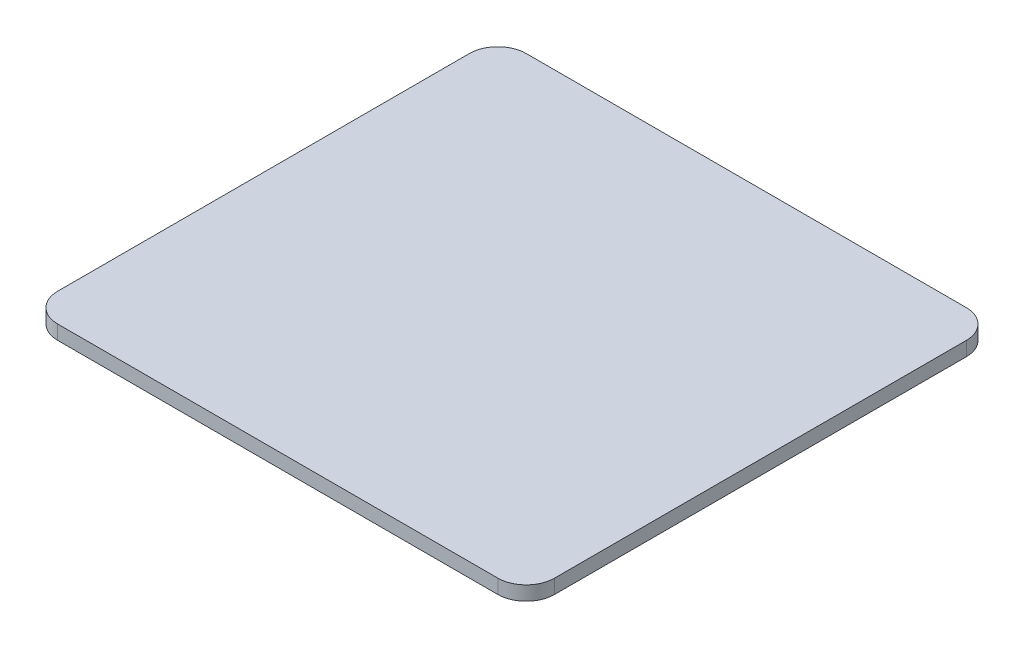
from build123d import *

# Parameters (mm, degrees)
RESSALTO_EXTRUS_O1_DEPTH = 5


with BuildPart() as part:
    # Esboço1 → Ressalto-extrusão1 (new body)
    with BuildSketch(Plane(origin=(0, 0, 0), x_dir=(1, 0, 0), z_dir=(0, 1, 0))):
        with BuildLine():
            Line((-25.612995536, 137.664689841), (129.387004464, 137.664689841))
            ThreePointArc((129.387004464, 137.664689841), (136.458072276, 134.735757653), (139.387004464, 127.664689841))
            Line((139.387004464, 127.664689841), (139.387004464, -17.335310159))
            ThreePointArc((139.387004464, -17.335310159), (136.458072276, -24.406377971), (129.387004464, -27.335310159))
            Line((129.387004464, -27.335310159), (-25.612995536, -27.335310159))
            ThreePointArc((-25.612995536, -27.335310159), (-32.684063348, -24.406377971), (-35.612995536, -17.335310159))
            Line((-35.612995536, -17.335310159), (-35.612995536, 127.664689841))
            ThreePointArc((-35.612995536, 127.664689841), (-32.684063348, 134.735757653), (-25.612995536, 137.664689841))
        make_face()
    extrude(amount=RESSALTO_EXTRUS_O1_DEPTH)


solid = part.part
